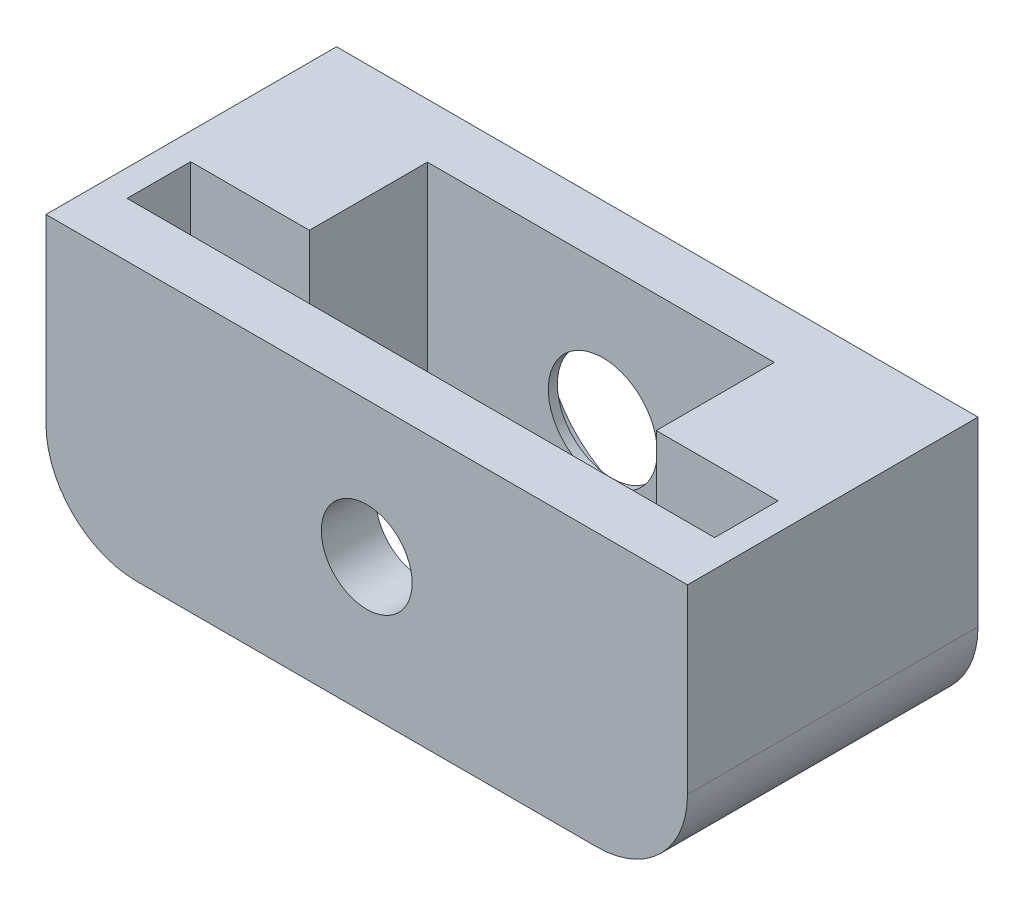
from build123d import *

# Parameters (mm, degrees)
SKETCH1_W           = 70.659898478
SKETCH1_H           = 30
BOSS_EXTRUDE1_DEPTH = 6
SKETCH2_R           = 5
CUT_EXTRUDE1_DEPTH  = 10
FILLET1_R           = 10
BOSS_EXTRUDE2_DEPTH = 7
BOSS_EXTRUDE3_DEPTH = 13
FILLET2_R           = 6
BOSS_EXTRUDE4_DEPTH = 6
SKETCH8_R           = 6
CUT_EXTRUDE2_DEPTH  = 30
SKETCH9_R           = 12.5
CUT_EXTRUDE3_DEPTH  = 5


with BuildPart() as part:
    # Sketch1 → Boss-Extrude1 (new body)
    with BuildSketch(Plane.XY):
        Rectangle(SKETCH1_W, SKETCH1_H)
    extrude(amount=BOSS_EXTRUDE1_DEPTH)

    # Sketch2 → Cut-Extrude1 (cut)
    with BuildSketch(Plane(origin=(0, 0, 0), x_dir=(-1, 0, 0), z_dir=(0, 0, -1))):
        Circle(SKETCH2_R)
    extrude(amount=-CUT_EXTRUDE1_DEPTH, mode=Mode.SUBTRACT)

    # Fillet1
    fillet1_edges = [part.edges().sort_by_distance(p)[0] for p in [
        (35.329949239, -15, 3),
        (-35.329949239, -15, 3),
    ]]
    fillet(fillet1_edges, radius=FILLET1_R)

    # Sketch4 → Boss-Extrude2 (add)
    with BuildSketch(Plane(origin=(0, 0, 0), x_dir=(-1, 0, 0), z_dir=(0, 0, -1))):
        with BuildLine():
            Line((-32.40101705, -12.071067812), (-32.316998846, 15))
            Line((-32.316998846, 15), (-35.329949239, 15))
            Line((-35.329949239, 15), (-35.329949239, -5))
            ThreePointArc((-35.329949239, -5), (-34.568744564, -8.826834324), (-32.40101705, -12.071067812))
        make_face()
        with BuildLine():
            Line((35.329949239, -5), (35.329949239, 15))
            Line((35.329949239, 15), (32.40101705, 15))
            Line((32.40101705, 15), (32.40101705, -12.071067812))
            ThreePointArc((32.40101705, -12.071067812), (34.568744564, -8.826834324), (35.329949239, -5))
        make_face()
    extrude(amount=BOSS_EXTRUDE2_DEPTH)

    # Sketch6 → Boss-Extrude3 (add)
    with BuildSketch(Plane(origin=(0, 0, -7), x_dir=(-1, 0, 0), z_dir=(0, 0, -1))):
        with BuildLine():
            Line((-18.889389891, 15), (-18.889389891, -15))
            Line((-18.889389891, -15), (-25.329949239, -15))
            ThreePointArc((-25.329949239, -15), (-32.40101705, -12.071067812), (-35.329949239, -5))
            Line((-35.329949239, -5), (-35.329949239, 15))
            Line((-35.329949239, 15), (-18.889389891, 15))
        make_face()
        with BuildLine():
            Line((19.317805732, 15), (19.317805732, -15))
            Line((19.317805732, -15), (25.329949239, -15))
            ThreePointArc((25.329949239, -15), (32.40101705, -12.071067812), (35.329949239, -5))
            Line((35.329949239, -5), (35.329949239, 15))
            Line((35.329949239, 15), (19.317805732, 15))
        make_face()
    extrude(amount=BOSS_EXTRUDE3_DEPTH)

    # Fillet2
    fillet2_edges = [part.edges().sort_by_distance(p)[0] for p in [
        (-19.317805732, -15, -13.5),
        (18.889389891, -15, -13.5),
    ]]
    fillet(fillet2_edges, radius=FILLET2_R)

    # Sketch7 → Boss-Extrude4 (add)
    with BuildSketch(Plane(origin=(0, 0, -20), x_dir=(-1, 0, 0), z_dir=(0, 0, -1))):
        with BuildLine():
            Line((-25.329949239, -15), (25.329949239, -15))
            ThreePointArc((25.329949239, -15), (32.40101705, -12.071067812), (35.329949239, -5))
            Line((35.329949239, -5), (35.329949239, 15))
            Line((35.329949239, 15), (-35.329949239, 15))
            Line((-35.329949239, 15), (-35.329949239, -5))
            ThreePointArc((-35.329949239, -5), (-32.40101705, -12.071067812), (-25.329949239, -15))
        make_face()
    extrude(amount=BOSS_EXTRUDE4_DEPTH)

    # Sketch8 → Cut-Extrude2 (cut)
    with BuildSketch(Plane.XY.offset(-20)):
        Circle(SKETCH8_R)
    extrude(amount=-CUT_EXTRUDE2_DEPTH, mode=Mode.SUBTRACT)

    # Sketch9 → Cut-Extrude3 (cut)
    with BuildSketch(Plane(origin=(0, 0, -26), x_dir=(-1, 0, 0), z_dir=(0, 0, -1))):
        Circle(SKETCH9_R)
    extrude(amount=-CUT_EXTRUDE3_DEPTH, mode=Mode.SUBTRACT)


solid = part.part
